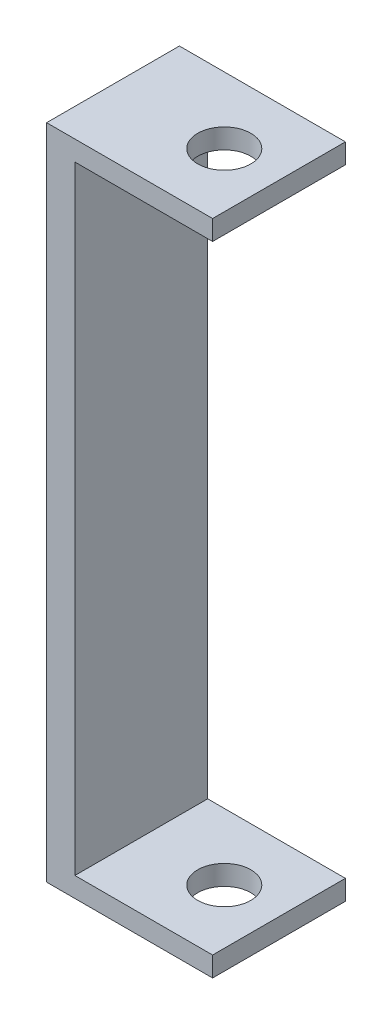
from build123d import *

# Parameters (mm, degrees)
SKETCH1_W           = 25
SKETCH1_H           = 20
SKETCH1_R           = 4
BOSS_EXTRUDE1_DEPTH = 3
SKETCH2_W           = 4.260066628
SKETCH2_H           = 20
BOSS_EXTRUDE2_DEPTH = 93.06
SKETCH3_W           = 25
SKETCH3_H           = 20
SKETCH3_R           = 4
BOSS_EXTRUDE3_DEPTH = 3


with BuildPart() as part:
    # Sketch1 → Boss-Extrude1 (new body)
    with BuildSketch(Plane(origin=(0, 0, 0), x_dir=(1, 0, 0), z_dir=(0, 1, 0))):
        with Locations((12.5, 10)):
            Rectangle(SKETCH1_W, SKETCH1_H)
        with Locations(Location((16.760066628, 10, 0), (0, 0, 270))):
            Circle(SKETCH1_R, mode=Mode.SUBTRACT)
    extrude(amount=BOSS_EXTRUDE1_DEPTH)

    # Sketch2 → Boss-Extrude2 (add)
    with BuildSketch(Plane(origin=(0, 3, 0), x_dir=(1, 0, 0), z_dir=(0, 1, 0))):
        with Locations((2.130033314, 10)):
            Rectangle(SKETCH2_W, SKETCH2_H)
    extrude(amount=BOSS_EXTRUDE2_DEPTH)

    # Sketch3 → Boss-Extrude3 (add)
    with BuildSketch(Plane(origin=(0, 96.06, 0), x_dir=(1, 0, 0), z_dir=(0, 1, 0))):
        with Locations((12.5, 10)):
            Rectangle(SKETCH3_W, SKETCH3_H)
        with Locations(Location((16.760066628, 10, 0), (0, 0, 270))):
            Circle(SKETCH3_R, mode=Mode.SUBTRACT)
    extrude(amount=BOSS_EXTRUDE3_DEPTH)


solid = part.part
